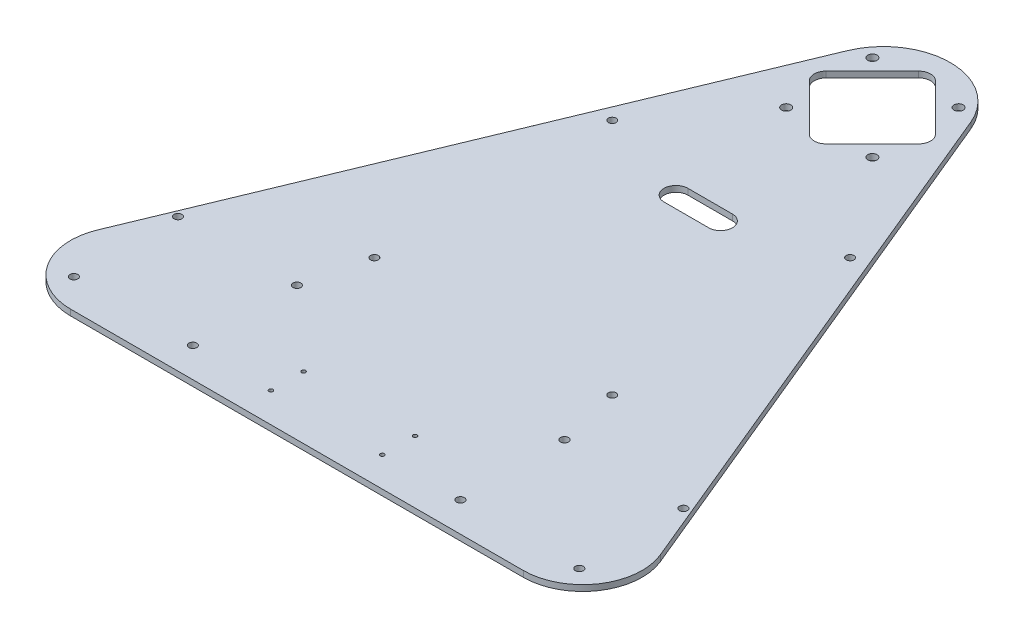
from build123d import *

# Parameters (mm, degrees)
SKETCH_2_R      = 3.1
SKETCH_2_R_2    = 2.65
SKETCH_2_R_3    = 1.35
SKETCH_2_R_4    = 2.6
EXTRUDE_2_DEPTH = 4


with BuildPart() as part:
    # 草图2 → 凸台-拉伸2 (new body)
    with BuildSketch(Plane(origin=(0, 0, 0), x_dir=(1, 0, 0), z_dir=(0, 1, 0))):
        with BuildLine():
            Line((-41.574578963, 199.630087618), (-189.22298515, -156.824697061))
            ThreePointArc((-189.22298515, -156.824697061), (-185.526588341, -194.354843677), (-152.267803849, -212.132034356))
            Line((-152.267803849, -212.132034356), (152.267803849, -212.132034356))
            ThreePointArc((152.267803849, -212.132034356), (185.526588341, -194.354843677), (189.22298515, -156.824697061))
            Line((189.22298515, -156.824697061), (41.574578963, 199.630087618))
            ThreePointArc((41.574578963, 199.630087618), (0, 227.409333161), (-41.574578963, 199.630087618))
        make_face()
        with Locations(Location((28.991378029, 203.991378029, 0), (0, 0, 270))):
            Circle(SKETCH_2_R, mode=Mode.SUBTRACT)
        with Locations(Location((-28.991378029, 203.991378029, 0), (0, 0, 90))):
            Circle(SKETCH_2_R, mode=Mode.SUBTRACT)
        with Locations(Location((28.991378029, 146.008621971, 0), (0, 0, 90))):
            Circle(SKETCH_2_R, mode=Mode.SUBTRACT)
        with Locations(Location((-28.991378029, 146.008621971, 0), (0, 0, 270))):
            Circle(SKETCH_2_R, mode=Mode.SUBTRACT)
        with Locations(Location((-170, -122.132034356, 0), (0, 0, 270))):
            Circle(SKETCH_2_R_2, mode=Mode.SUBTRACT)
        with Locations(Location((-90, -122.132034356, 0), (0, 0, 270))):
            Circle(SKETCH_2_R_2, mode=Mode.SUBTRACT)
        with Locations(Location((-90, -192.132034356, 0), (0, 0, 270))):
            Circle(SKETCH_2_R_2, mode=Mode.SUBTRACT)
        with Locations(Location((-170, -192.132034356, 0), (0, 0, 270))):
            Circle(SKETCH_2_R_2, mode=Mode.SUBTRACT)
        with Locations(Location((90, -192.132034356, 0), (0, 0, 90))):
            Circle(SKETCH_2_R_2, mode=Mode.SUBTRACT)
        with Locations(Location((170, -192.132034356, 0), (0, 0, 90))):
            Circle(SKETCH_2_R_2, mode=Mode.SUBTRACT)
        with Locations(Location((90, -122.132034356, 0), (0, 0, 90))):
            Circle(SKETCH_2_R_2, mode=Mode.SUBTRACT)
        with Locations(Location((170, -122.132034356, 0), (0, 0, 90))):
            Circle(SKETCH_2_R_2, mode=Mode.SUBTRACT)
        with Locations(Location((37.5, -170.132034356, 0), (0, 0, 270))):
            Circle(SKETCH_2_R_3, mode=Mode.SUBTRACT)
        with Locations(Location((-37.5, -170.132034356, 0), (0, 0, 270))):
            Circle(SKETCH_2_R_3, mode=Mode.SUBTRACT)
        with Locations(Location((-37.5, -192.132034356, 0), (0, 0, 270))):
            Circle(SKETCH_2_R_3, mode=Mode.SUBTRACT)
        with Locations(Location((37.5, -192.132034356, 0), (0, 0, 270))):
            Circle(SKETCH_2_R_3, mode=Mode.SUBTRACT)
        with Locations(Location((-80, 80, 0), (0, 0, 270))):
            Circle(SKETCH_2_R_4, mode=Mode.SUBTRACT)
        with Locations(Location((80, 80, 0), (0, 0, 270))):
            Circle(SKETCH_2_R_4, mode=Mode.SUBTRACT)
        with Locations(Location((80, -80, 0), (0, 0, 270))):
            Circle(SKETCH_2_R_4, mode=Mode.SUBTRACT)
        with Locations(Location((-80, -80, 0), (0, 0, 270))):
            Circle(SKETCH_2_R_4, mode=Mode.SUBTRACT)
        with BuildLine():
            Line((-36.769552622, 180.656854249), (-5.656854249, 211.769552622))
            ThreePointArc((-5.656854249, 211.769552622), (0, 214.112698372), (5.656854249, 211.769552622))
            Line((5.656854249, 211.769552622), (36.769552622, 180.656854249))
            ThreePointArc((36.769552622, 180.656854249), (39.112698372, 175), (36.769552622, 169.343145751))
            Line((36.769552622, 169.343145751), (5.656854249, 138.230447378))
            ThreePointArc((5.656854249, 138.230447378), (0, 135.887301628), (-5.656854249, 138.230447378))
            Line((-5.656854249, 138.230447378), (-36.769552622, 169.343145751))
            ThreePointArc((-36.769552622, 169.343145751), (-39.112698372, 175), (-36.769552622, 180.656854249))
        make_face(mode=Mode.SUBTRACT)
        with BuildLine():
            Line((-15, 65.867965644), (15, 65.867965644))
            ThreePointArc((15, 65.867965644), (23, 57.867965644), (15, 49.867965644))
            Line((15, 49.867965644), (-15, 49.867965644))
            ThreePointArc((-15, 49.867965644), (-23, 57.867965644), (-15, 65.867965644))
        make_face(mode=Mode.SUBTRACT)
    extrude(amount=EXTRUDE_2_DEPTH)


solid = part.part
